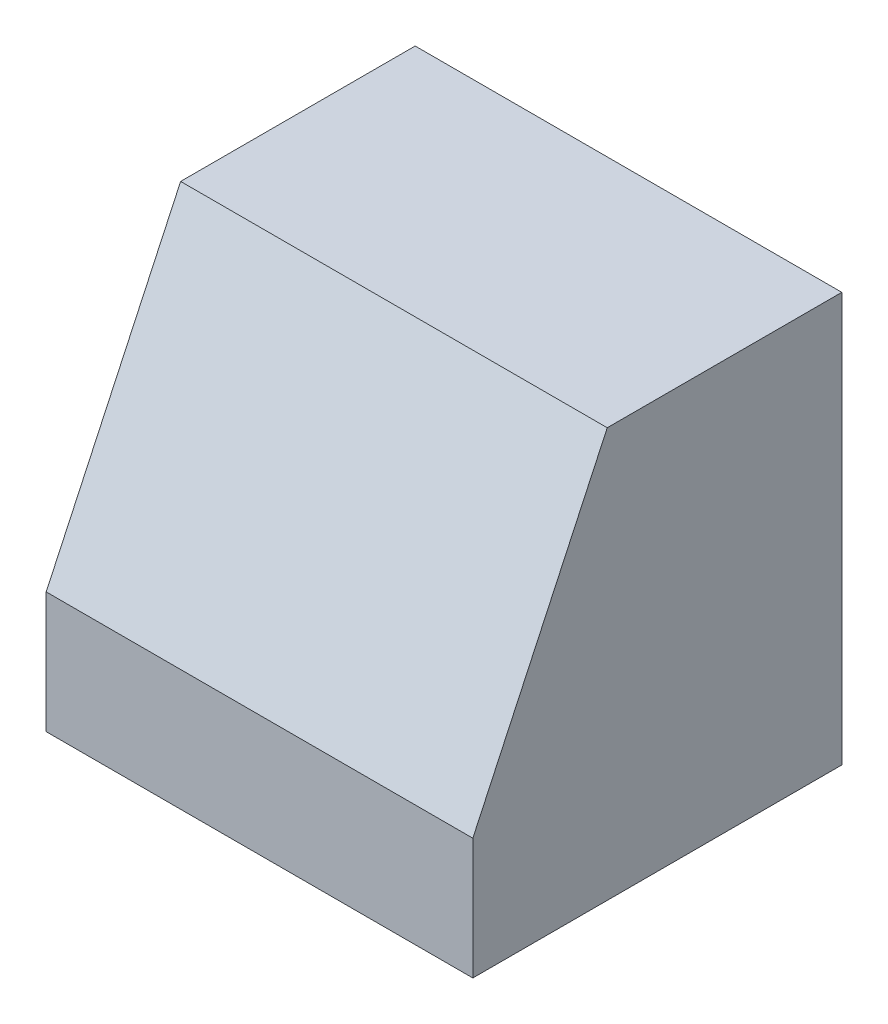
from build123d import *

# Parameters (mm, degrees)
SKETCH_1_W      = 7.4
SKETCH_1_H      = 7.1
EXTRUDE_1_DEPTH = 6.4
SKETCH_1_3_R    = 1.75
EXTRUDE_2_DEPTH = 1.3
CHAMFER_1_SIZE  = 5
CHAMFER_1_SIZE2 = 2.331538291


with BuildPart() as part:
    # Эскиз1 → Бобышка-Вытянуть1 (new body)
    with BuildSketch(Plane.XY):
        with Locations((-2.9453125, -2.68046875)):
            Rectangle(SKETCH_1_W, SKETCH_1_H)
    extrude(amount=EXTRUDE_1_DEPTH)

    # Эскиз1<3> → Бобышка-Вытянуть2 (add)
    with BuildSketch(Plane.XY):
        with Locations((-2.9453125, -2.38046875)):
            Circle(SKETCH_1_3_R)
    extrude(amount=-EXTRUDE_2_DEPTH)

    # Фаска1
    chamfer_1_edges = [part.edges().sort_by_distance(p)[0] for p in [
        (-2.9453125, 0.86953125, 6.4),
    ]]
    chamfer_1_side = [part.faces().sort_by_distance(p)[0] for p in [
        (-2.9453125, -2.68046875, 6.4),
    ]]
    chamfer(chamfer_1_edges, length=CHAMFER_1_SIZE, length2=CHAMFER_1_SIZE2, reference=chamfer_1_side[0])


solid = part.part
